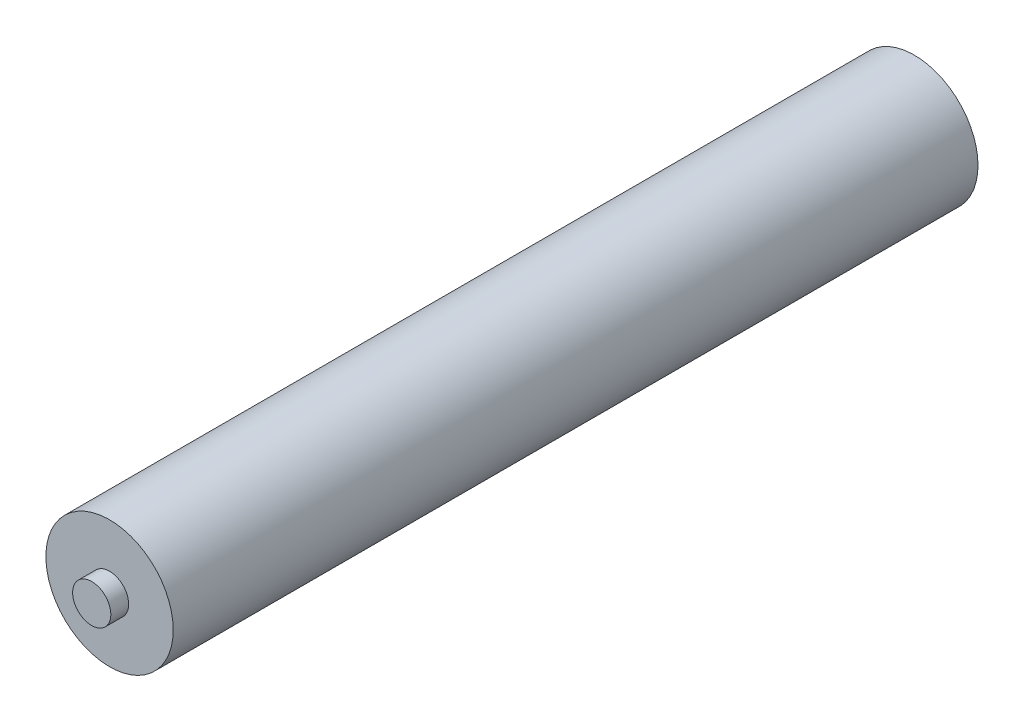
from build123d import *

# Parameters (mm, degrees)
SKETCH1_R           = 12.5
BOSS_EXTRUDE1_DEPTH = 79
SKETCH2_R           = 3.75
BOSS_EXTRUDE2_DEPTH = 3.5


with BuildPart() as part:
    # Sketch1 → Boss-Extrude1 (new, symmetric)
    with BuildSketch(Plane.XY):
        Circle(SKETCH1_R)
    extrude(amount=BOSS_EXTRUDE1_DEPTH, both=True)

    # Sketch2 → Boss-Extrude2 (add, symmetric)
    with BuildSketch(Plane.XY.offset(79)):
        Circle(SKETCH2_R)
    boss_extrude2 = extrude(amount=BOSS_EXTRUDE2_DEPTH, both=True)

    # Mirror1: Boss-Extrude2 across plane
    add(boss_extrude2.mirror(Plane.XY))


solid = part.part
